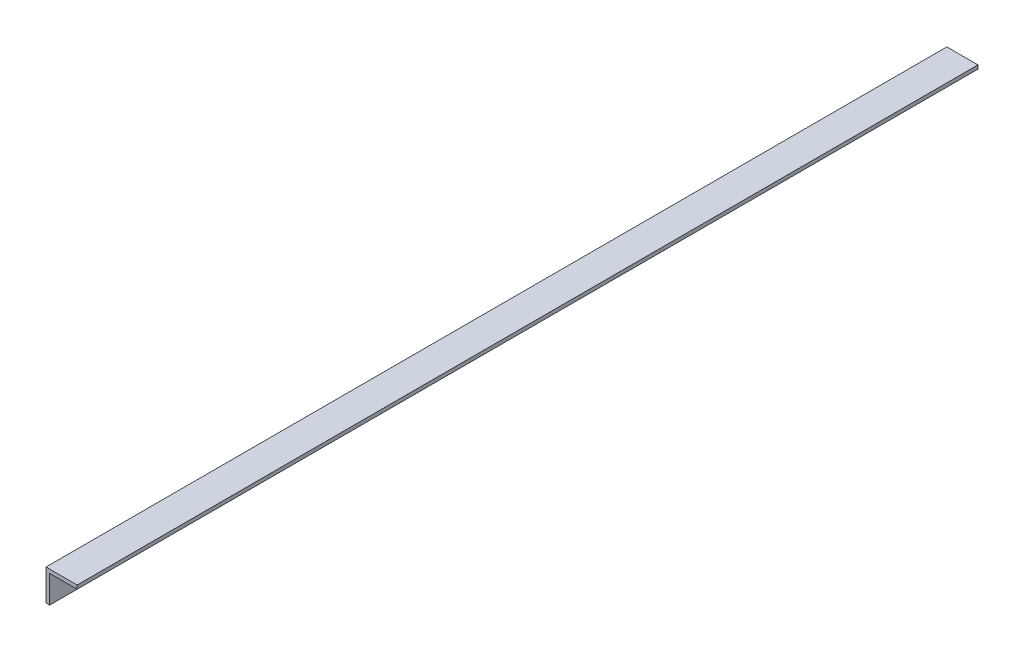
from build123d import *

# Parameters (mm, degrees)
SALIENTE_EXTRUIR1_DEPTH = 367.1


with BuildPart() as part:
    # Croquis1 → Saliente-Extruir1 (new body)
    with BuildSketch(Plane.XY):
        Polygon((0, -1.5), (-11.2, -1.5), (-11.2, -12.7), (-12.7, -12.7), (-12.7, 0), (0, 0), align=None)
    extrude(amount=SALIENTE_EXTRUIR1_DEPTH)


solid = part.part
